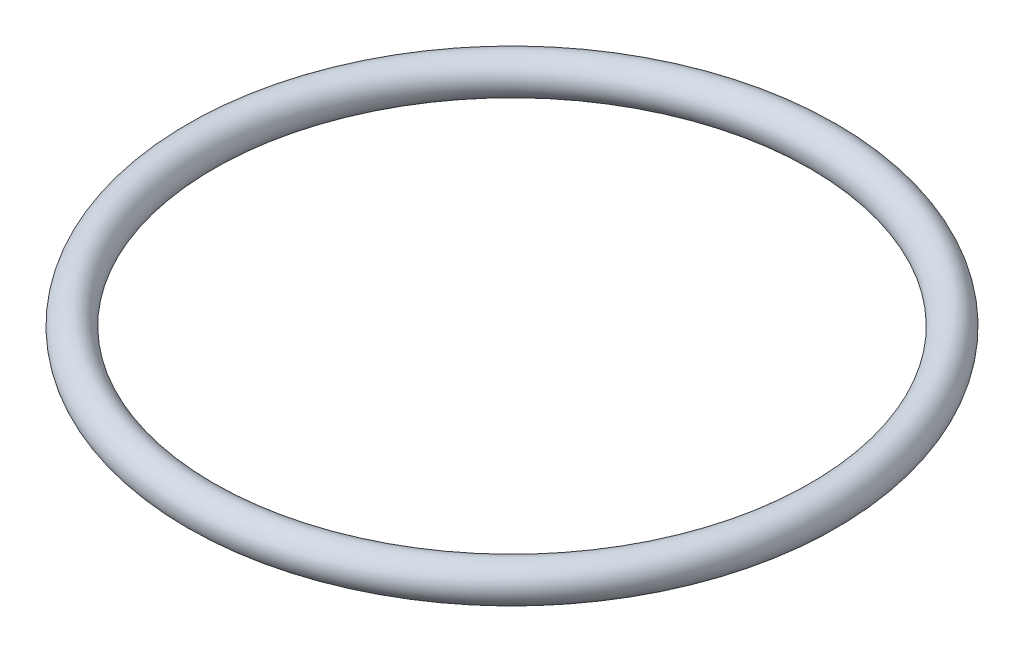
from build123d import *

# Parameters (mm, degrees)
SZKIC1_R = 1.5


with BuildPart() as part:
    # Szkic1 → Obrót1 (revolve)
    with BuildSketch(Plane.XY, mode=Mode.PRIVATE) as obr_t1_sk:
        with Locations((-25.5, -1.38996772)):
            Circle(SZKIC1_R)
    revolve(obr_t1_sk.sketch.rotate(Axis((0, 5.124503541, 0), (0, -1, 0)), 270), axis=Axis((0, 5.124503541, 0), (0, -1, 0)))


solid = part.part
